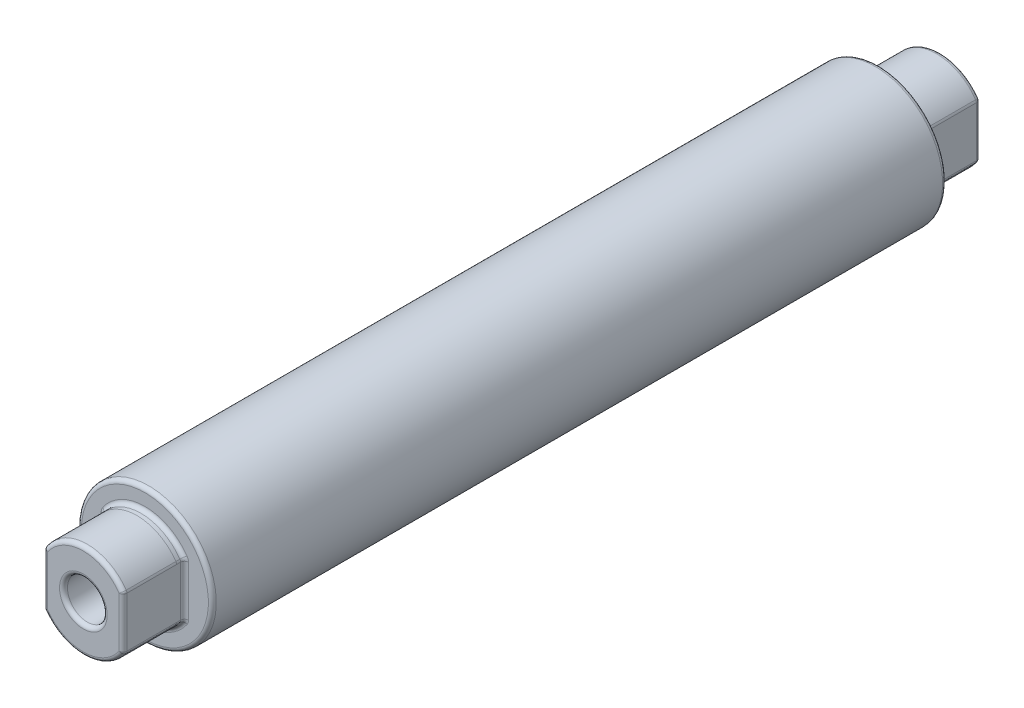
from build123d import *

# Parameters (mm, degrees)
CORTAR_EXTRUIR1_REACH = 57.322
REDONDEO2_R           = 0.5


with BuildPart() as part:
    # Croquis1 → Revolución4 (revolve)
    with BuildSketch(Plane(origin=(0, 0, 0), x_dir=(0, 0, -1), z_dir=(1, 0, 0)), mode=Mode.PRIVATE) as revoluci_n4_sk:
        Polygon((-46.25, 8.5), (-46.25, 6), (-47.25, 6), (-54, 6), (-54, 2.5), (-46.25, 2.5), (0, 2.5), (0, 8.5), align=None)
    revolve(revoluci_n4_sk.sketch.rotate(Axis((0, 0, 55.074829932), (0, 0, -1)), 90), axis=Axis((0, 0, 55.074829932), (0, 0, -1)))

    # Cortar-Extruir1: up to this face of the body (flat: up to its plane)
    cortar_extruir1_end = Plane(part.part.faces().sort_by_distance((-8.259583694, 0, 46.25))[0])
    # Croquis3 → Cortar-Extruir1 (cut, up to the picked face)
    with BuildSketch(Plane.XY.offset(54), mode=Mode.PRIVATE) as cortar_extruir1_sk1:
        with BuildLine():
            Line((-5, 3.31662479), (-5, -3.31662479))
            ThreePointArc((-5, -3.31662479), (-6, 0), (-5, 3.31662479))
        make_face()
    cortar_extruir1_tool1 = split(extrude(cortar_extruir1_sk1.sketch, amount=-CORTAR_EXTRUIR1_REACH, mode=Mode.PRIVATE), bisect_by=cortar_extruir1_end, keep=Keep.BOTH, mode=Mode.PRIVATE)
    # Croquis3 → Cortar-Extruir1 (cut, up to the picked face)
    with BuildSketch(Plane.XY.offset(54), mode=Mode.PRIVATE) as cortar_extruir1_sk2:
        with BuildLine():
            Line((5, 3.31662479), (5, -3.31662479))
            ThreePointArc((5, -3.31662479), (6, 0), (5, 3.31662479))
        make_face()
    cortar_extruir1_tool2 = split(extrude(cortar_extruir1_sk2.sketch, amount=-CORTAR_EXTRUIR1_REACH, mode=Mode.PRIVATE), bisect_by=cortar_extruir1_end, keep=Keep.BOTH, mode=Mode.PRIVATE)
    add(cortar_extruir1_tool1.solids().sort_by(Axis((-5.403002, 0, 54), (0, 0, -1)))[0], mode=Mode.SUBTRACT)
    add(cortar_extruir1_tool2.solids().sort_by(Axis((5.403002, 0, 54), (0, 0, -1)))[0], mode=Mode.SUBTRACT)

    # Redondeo2
    redondeo2_edges = [part.edges().sort_by_distance(p)[0] for p in [
        (0, -6, 54),
        (0, -6, 46.25),
        (5, 3.31662479, 50.125),
        (5, 0, 54),
        (5, 0, 46.25),
        (5, -3.31662479, 50.125),
        (5, -3.31662479, 50.125),
        (5, 3.31662479, 50.125),
        (-5, 0, 54),
        (-5, 0, 46.25),
        (-5, 3.31662479, 50.125),
        (-5, 3.31662479, 50.125),
        (-2.5, 0, 54),
        (0, 6, 54),
        (0, 6, 46.25),
        (-8.5, 0, 46.25),
    ]]
    fillet(redondeo2_edges, radius=REDONDEO2_R)

    # Simetría1: part across plane


with BuildPart() as part_1:
    add(part.part)
    add(part.part.mirror(Plane.XY))


solid = part_1.part
